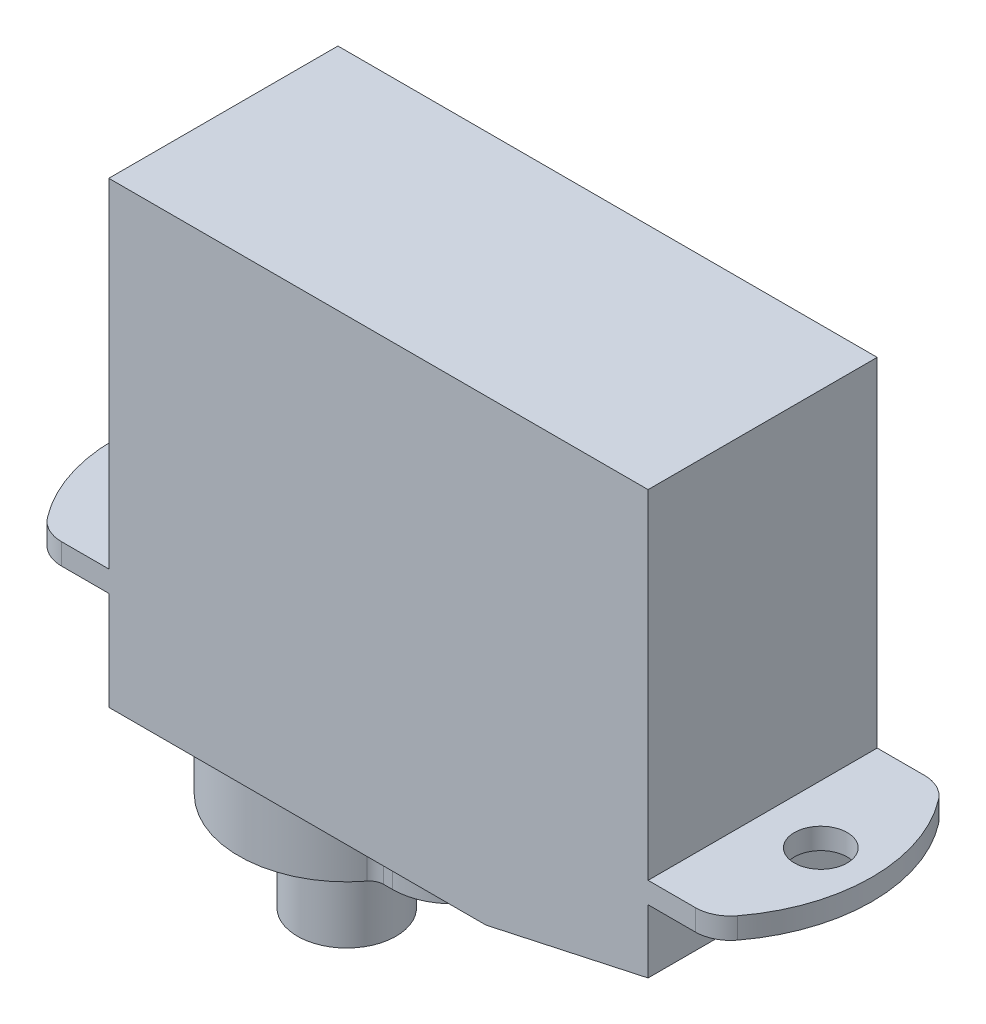
from build123d import *

# Parameters (mm, degrees)
SKETCH1_W           = 19.431
SKETCH1_H           = 8.255
BOSS_EXTRUDE1_DEPTH = 16.51
SKETCH2_R           = 0.9525
BOSS_EXTRUDE2_DEPTH = 0.762
CUT_EXTRUDE1_DEPTH  = 23.959004361
BOSS_EXTRUDE3_DEPTH = 2.54
SKETCH5_R           = 1.778
BOSS_EXTRUDE4_DEPTH = 3.556


with BuildPart() as part:
    # Sketch1 → Boss-Extrude1 (new body)
    with BuildSketch(Plane(origin=(0, 0, 0), x_dir=(1, 0, 0), z_dir=(0, 1, 0))):
        Rectangle(SKETCH1_W, SKETCH1_H)
    extrude(amount=BOSS_EXTRUDE1_DEPTH)

    # Sketch2 → Boss-Extrude2 (add)
    # profile 1 of 2: a face of its own
    with BuildSketch(Plane(origin=(0, 4.318, 0), x_dir=(1, 0, 0), z_dir=(0, 1, 0))):
        with BuildLine():
            Line((9.7155, -4.1275), (9.7155, 4.1275))
            Line((9.7155, 4.1275), (11.417923657, 4.1275))
            ThreePointArc((11.417923657, 4.1275), (11.981565763, 3.995571868), (12.428105113, 3.62719697))
            ThreePointArc((12.428105113, 3.62719697), (13.6525, 0), (12.428105113, -3.62719697))
            ThreePointArc((12.428105113, -3.62719697), (11.981565763, -3.995571868), (11.417923657, -4.1275))
            Line((11.417923657, -4.1275), (9.7155, -4.1275))
        make_face()
        with Locations(Location((11.811, 0, 0), (0, 0, 270))):
            Circle(SKETCH2_R, mode=Mode.SUBTRACT)
    # profile 2 of 2: a face of its own
    with BuildSketch(Plane(origin=(0, 4.318, 0), x_dir=(1, 0, 0), z_dir=(0, 1, 0))):
        with BuildLine():
            Line((-9.7155, 4.1275), (-9.7155, -4.1275))
            Line((-9.7155, -4.1275), (-11.417923657, -4.1275))
            ThreePointArc((-11.417923657, -4.1275), (-11.981565763, -3.995571868), (-12.428105113, -3.62719697))
            ThreePointArc((-12.428105113, -3.62719697), (-13.6525, 0), (-12.428105113, 3.62719697))
            ThreePointArc((-12.428105113, 3.62719697), (-11.981565763, 3.995571868), (-11.417923657, 4.1275))
            Line((-11.417923657, 4.1275), (-9.7155, 4.1275))
        make_face()
        with Locations(Location((-11.811, 0, 0), (0, 0, 270))):
            Circle(SKETCH2_R, mode=Mode.SUBTRACT)
    extrude(amount=-BOSS_EXTRUDE2_DEPTH)

    # Sketch3 → Cut-Extrude1 (cut, through all)
    with BuildSketch(Plane.XY.offset(4.1275)):
        Polygon((9.7155, 0), (3.8735, 0), (9.7155, 1.27), align=None)
    extrude(amount=-CUT_EXTRUDE1_DEPTH, mode=Mode.SUBTRACT)

    # Sketch4 → Boss-Extrude3 (add)
    with BuildSketch(Plane.XZ):
        with BuildLine():
            Line((-1.4605, 2.159), (-1.778207824, 2.159))
            ThreePointArc((-1.778207824, 2.159), (-2.003413909, 2.211647148), (-2.181941024, 2.358676301))
            ThreePointArc((-2.181941024, 2.358676301), (-9.1567, 0), (-2.181941024, -2.358676301))
            ThreePointArc((-2.181941024, -2.358676301), (-2.003413909, -2.211647148), (-1.778207824, -2.159))
            Line((-1.778207824, -2.159), (-1.4605, -2.159))
            ThreePointArc((-1.4605, -2.159), (0.6985, 0), (-1.4605, 2.159))
        make_face()
    extrude(amount=BOSS_EXTRUDE3_DEPTH)

    # Sketch5 → Boss-Extrude4 (add)
    with BuildSketch(Plane.XZ.offset(2.54)):
        with Locations(Location((-5.2705, 0, 0), (0, 0, 270))):
            Circle(SKETCH5_R)
    extrude(amount=BOSS_EXTRUDE4_DEPTH)


solid = part.part
